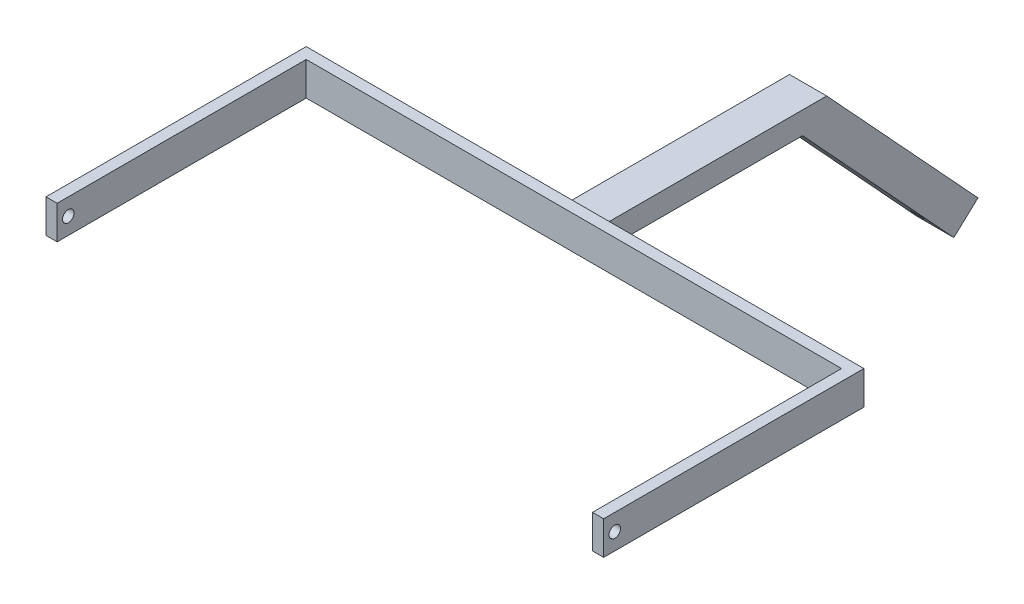
from build123d import *

# Parameters (mm, degrees)
EXTRUDE_2_DEPTH     = 6
SKETCH_2_R          = 1.55
CUT_EXTRUDE_1_DEPTH = 10
SKETCH_3_R          = 1.55
CUT_EXTRUDE_2_DEPTH = 10
EXTRUDE_4_DEPTH     = 1.5
EXTRUDE_5_DEPTH     = 1.5
SKETCH_5_W          = 6
SKETCH_5_H          = 6
EXTRUDE_6_DEPTH     = 60
CUT_EXTRUDE_3_DEPTH = 60
SKETCH_9_W          = 6
SKETCH_9_H          = 8.845903007
EXTRUDE_7_DEPTH     = 60
SKETCH_11_R         = 1.55
CUT_EXTRUDE_5_DEPTH = 10
SKETCH_10_W         = 5
SKETCH_10_H         = 4
CUT_EXTRUDE_6_DEPTH = 10
EXTRUDE_8_DEPTH     = 2
EXTRUDE_9_DEPTH     = 2


with BuildPart() as part:
    # 草图1 → 凸台-拉伸2 (new body)
    with BuildSketch(Plane(origin=(0, 0, 0), x_dir=(1, 0, 0), z_dir=(0, 1, 0))):
        Polygon((-72.757575758, -68.484848485), (-72.757575758, -1.484848485), (71.242424242, -1.484848485), (71.242424242, -68.484848485), (74.242424242, -68.484848485), (74.242424242, -1.484848485), (74.242424242, 1.515151515), (71.242424242, 1.515151515), (-72.757575758, 1.515151515), (-75.757575758, 1.515151515), (-75.757575758, -1.484848485), (-75.757575758, -68.484848485), align=None)
    extrude(amount=EXTRUDE_2_DEPTH)

    # 草图2 → 切除-拉伸1 (cut)
    with BuildSketch(Plane(origin=(-72.757575758, 0, 0), x_dir=(0, 0, -1), z_dir=(1, 0, 0))):
        with Locations((-65.484848485, 3)):
            Circle(SKETCH_2_R)
    extrude(amount=-CUT_EXTRUDE_1_DEPTH, mode=Mode.SUBTRACT)

    # 草图3 → 切除-拉伸2 (cut)
    with BuildSketch(Plane(origin=(74.242424242, 0, 0), x_dir=(0, 0, -1), z_dir=(1, 0, 0))):
        with Locations((-65.484848485, 3)):
            Circle(SKETCH_3_R)
    extrude(amount=-CUT_EXTRUDE_2_DEPTH, mode=Mode.SUBTRACT)

    # 草图6 → 凸台-拉伸4 (add)
    with BuildSketch(Plane(origin=(0, 6, 0), x_dir=(1, 0, 0), z_dir=(0, 1, 0))):
        Polygon((-75.757575758, 1.515151515), (74.242424242, 1.515151515), (74.242424242, -68.484848485), (71.242424242, -68.484848485), (71.242424242, -1.484848485), (-72.757575758, -1.484848485), (-72.757575758, -68.484848485), (-75.757575758, -68.484848485), align=None)
    extrude(amount=EXTRUDE_4_DEPTH)

    # 草图7 → 凸台-拉伸5 (add)
    with BuildSketch(Plane.XZ):
        Polygon((-75.757575758, 68.484848485), (-75.757575758, -1.515151515), (74.242424242, -1.515151515), (74.242424242, 68.484848485), (71.242424242, 68.484848485), (71.242424242, 1.484848485), (-72.757575758, 1.484848485), (-72.757575758, 68.484848485), align=None)
    extrude(amount=EXTRUDE_5_DEPTH)

    # 草图5 → 凸台-拉伸6 (add)
    with BuildSketch(Plane(origin=(0, 0, -1.515151515), x_dir=(-1, 0, 0), z_dir=(0, 0, -1))):
        with Locations((0.757575758, 3)):
            Rectangle(SKETCH_5_W, SKETCH_5_H)
    extrude(amount=EXTRUDE_6_DEPTH)

    # 草图8 → 切除-拉伸3 (cut)
    with BuildSketch(Plane(origin=(2.242424242, 0, 0), x_dir=(0, 0, -1), z_dir=(1, 0, 0))):
        Polygon((61.515151515, 6), (55.015151515, 0), (61.515151515, 0), align=None)
    extrude(amount=-CUT_EXTRUDE_3_DEPTH, mode=Mode.SUBTRACT)

    # 草图9 → 凸台-拉伸7 (add)
    with BuildSketch(Plane(origin=(0, -27.419692129, -25.310485042), x_dir=(1, 0, 0), z_dir=(0, -0.7348034446274878, -0.678280102733066))):
        with Locations((-0.757575758, -44.848274344)):
            Rectangle(SKETCH_9_W, SKETCH_9_H)
    extrude(amount=EXTRUDE_7_DEPTH)

    # 草图11 → 切除-拉伸5 (cut)
    with BuildSketch(Plane(origin=(0, 33.419692129, -36.204666473), x_dir=(-1, 0, 0), z_dir=(0, 0.6782801027330662, -0.7348034446274876))):
        with Locations(Location((0.757575758, -90.315682622, 0), (0, 0, 90))):
            Circle(SKETCH_11_R)
    extrude(amount=-CUT_EXTRUDE_5_DEPTH, mode=Mode.SUBTRACT)

    # 草图10 → 切除-拉伸6 (cut)
    with BuildSketch(Plane(origin=(0, -71.507898807, -66.007291206), x_dir=(1, 0, 0), z_dir=(0, -0.7348034446274876, -0.6782801027330662))):
        with Locations((-0.757575758, -44.848274343)):
            Rectangle(SKETCH_10_W, SKETCH_10_H)
    extrude(amount=-CUT_EXTRUDE_6_DEPTH, mode=Mode.SUBTRACT)

    # 草图12 → 凸台-拉伸8 (add)
    with BuildSketch(Plane.ZY.offset(3.757575758)):
        Polygon((-102.211957679, -38.088206678), (-95.711957679, -44.088206678), (-55.015151515, 0), (-1.515151515, 0), (-1.515151515, 6), (-61.515151515, 6), align=None)
    extrude(amount=EXTRUDE_8_DEPTH)

    # 草图13 → 凸台-拉伸9 (add)
    with BuildSketch(Plane(origin=(2.242424242, 0, 0), x_dir=(0, 0, -1), z_dir=(1, 0, 0))):
        Polygon((95.711957679, -44.088206678), (102.211957679, -38.088206678), (61.515151515, 6), (1.515151515, 6), (1.515151515, 0), (55.015151515, 0), align=None)
    extrude(amount=EXTRUDE_9_DEPTH)


solid = part.part
